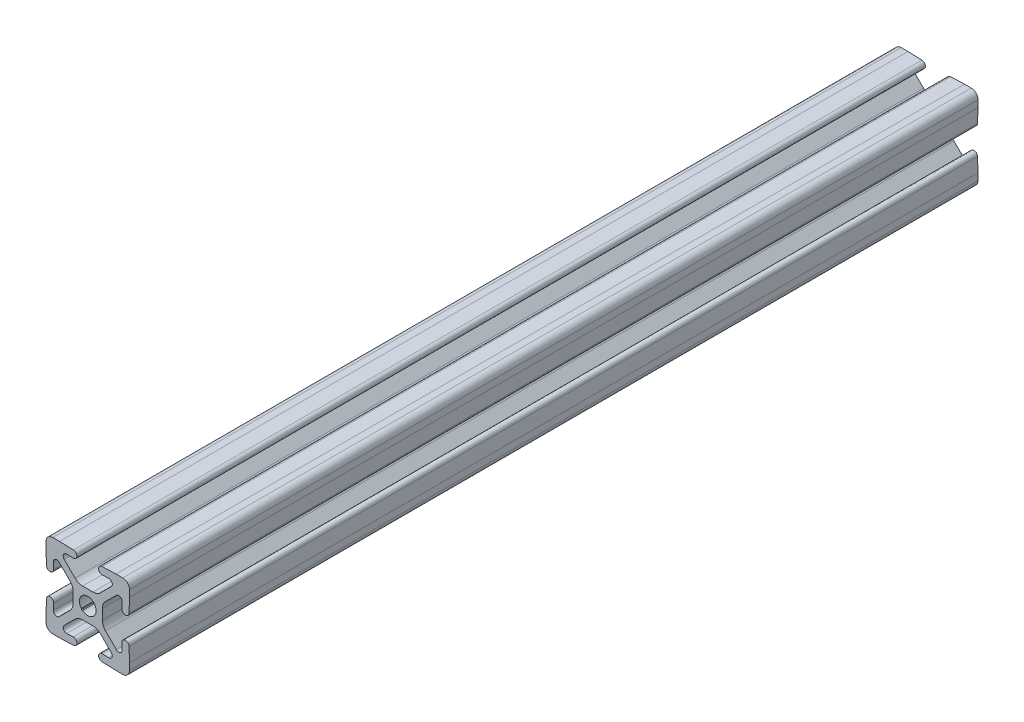
from build123d import *

# Parameters (mm, degrees)
BOSS_EXTRUDE1_DEPTH = 254


with BuildPart() as part:
    # Model → Boss-Extrude1 (new body)
    with BuildSketch(Plane.XY):
        with BuildLine():
            Line((50.659960212, 72.999871414), (53.774553856, 72.999871414))
            ThreePointArc((53.774553856, 72.999871414), (54.989573754, 72.758188929), (56.019617887, 72.069935444))
            Line((56.019617887, 72.069935444), (59.264200891, 68.825352439))
            ThreePointArc((59.264200891, 68.825352439), (59.477513437, 67.701802895), (58.510322513, 67.091550869))
            Line((58.510322513, 67.091550869), (56.572487817, 67.159221548))
            ThreePointArc((56.572487817, 67.159221548), (55.4691069, 66.130302197), (56.498026251, 65.026921279))
            Line((56.498026251, 65.026921279), (60.677257034, 64.880979325))
            Line((60.677257034, 64.880979325), (62.710657034, 64.880979325))
            ThreePointArc((62.710657034, 64.880979325), (64.129537501, 65.468698857), (64.717257034, 66.887579325))
            Line((64.717257034, 66.887579325), (64.717257034, 68.920979325))
            Line((64.717257034, 68.920979325), (64.57131508, 73.100210108))
            ThreePointArc((64.57131508, 73.100210108), (63.467934162, 74.129129459), (62.439014811, 73.025748542))
            Line((62.439014811, 73.025748542), (62.50668549, 71.087913846))
            ThreePointArc((62.50668549, 71.087913846), (61.896433464, 70.120722922), (60.77288392, 70.334035468))
            Line((60.77288392, 70.334035468), (57.528300915, 73.578618472))
            ThreePointArc((57.528300915, 73.578618472), (56.84004743, 74.608662605), (56.598364945, 75.823682503))
            Line((56.598364945, 75.823682503), (56.598364945, 78.938276147))
            ThreePointArc((56.598364945, 78.938276147), (56.84004743, 80.153296044), (57.528300915, 81.183340177))
            Line((57.528300915, 81.183340177), (60.77288392, 84.427923182))
            ThreePointArc((60.77288392, 84.427923182), (61.896433464, 84.641235728), (62.50668549, 83.674044803))
            Line((62.50668549, 83.674044803), (62.439014811, 81.736210108))
            ThreePointArc((62.439014811, 81.736210108), (63.467934162, 80.63282919), (64.57131508, 81.661748542))
            Line((64.57131508, 81.661748542), (64.717257034, 85.840979325))
            Line((64.717257034, 85.840979325), (64.717257034, 87.874379325))
            ThreePointArc((64.717257034, 87.874379325), (64.129537501, 89.293259792), (62.710657034, 89.880979325))
            Line((62.710657034, 89.880979325), (60.677257034, 89.880979325))
            Line((60.677257034, 89.880979325), (56.498026251, 89.73503737))
            ThreePointArc((56.498026251, 89.73503737), (55.4691069, 88.631656452), (56.572487817, 87.602737101))
            Line((56.572487817, 87.602737101), (58.510322513, 87.67040778))
            ThreePointArc((58.510322513, 87.67040778), (59.477513437, 87.060155754), (59.264200891, 85.93660621))
            Line((59.264200891, 85.93660621), (56.019617887, 82.692023205))
            ThreePointArc((56.019617887, 82.692023205), (54.989573754, 82.00376972), (53.774553856, 81.762087236))
            Line((53.774553856, 81.762087236), (50.659960212, 81.762087236))
            ThreePointArc((50.659960212, 81.762087236), (49.444940315, 82.00376972), (48.414896182, 82.692023205))
            Line((48.414896182, 82.692023205), (45.170313177, 85.93660621))
            ThreePointArc((45.170313177, 85.93660621), (44.957000631, 87.060155754), (45.924191556, 87.67040778))
            Line((45.924191556, 87.67040778), (47.862026251, 87.602737101))
            ThreePointArc((47.862026251, 87.602737101), (48.965407169, 88.631656452), (47.936487817, 89.73503737))
            Line((47.936487817, 89.73503737), (43.757257034, 89.880979325))
            Line((43.757257034, 89.880979325), (41.723857034, 89.880979325))
            ThreePointArc((41.723857034, 89.880979325), (40.304976567, 89.293259792), (39.717257034, 87.874379325))
            Line((39.717257034, 87.874379325), (39.717257034, 85.840979325))
            Line((39.717257034, 85.840979325), (39.863198989, 81.661748542))
            ThreePointArc((39.863198989, 81.661748542), (40.966579907, 80.63282919), (41.995499258, 81.736210108))
            Line((41.995499258, 81.736210108), (41.927828579, 83.674044803))
            ThreePointArc((41.927828579, 83.674044803), (42.538080605, 84.641235728), (43.661630149, 84.427923182))
            Line((43.661630149, 84.427923182), (46.906213154, 81.183340177))
            ThreePointArc((46.906213154, 81.183340177), (47.594466639, 80.153296044), (47.836149123, 78.938276147))
            Line((47.836149123, 78.938276147), (47.836149123, 75.823682503))
            ThreePointArc((47.836149123, 75.823682503), (47.594466639, 74.608662605), (46.906213154, 73.578618472))
            Line((46.906213154, 73.578618472), (43.661630149, 70.334035468))
            ThreePointArc((43.661630149, 70.334035468), (42.538080605, 70.120722922), (41.927828579, 71.087913846))
            Line((41.927828579, 71.087913846), (41.995499258, 73.025748542))
            ThreePointArc((41.995499258, 73.025748542), (40.966579907, 74.129129459), (39.863198989, 73.100210108))
            Line((39.863198989, 73.100210108), (39.717257034, 68.920979325))
            Line((39.717257034, 68.920979325), (39.717257034, 66.887579325))
            ThreePointArc((39.717257034, 66.887579325), (40.304976567, 65.468698857), (41.723857034, 64.880979325))
            Line((41.723857034, 64.880979325), (43.757257034, 64.880979325))
            Line((43.757257034, 64.880979325), (47.936487817, 65.026921279))
            ThreePointArc((47.936487817, 65.026921279), (48.965407169, 66.130302197), (47.862026251, 67.159221548))
            Line((47.862026251, 67.159221548), (45.924191556, 67.091550869))
            ThreePointArc((45.924191556, 67.091550869), (44.957000631, 67.701802895), (45.170313177, 68.825352439))
            Line((45.170313177, 68.825352439), (48.414896182, 72.069935444))
            ThreePointArc((48.414896182, 72.069935444), (49.444940315, 72.758188929), (50.659960212, 72.999871414))
        make_face()
        with BuildLine():
            Line((50.64953831, 75.433607249), (50.269884959, 75.433607249))
            Line((50.269884959, 75.433607249), (50.269884959, 75.8132606))
            ThreePointArc((50.269884959, 75.8132606), (53.985023987, 79.148746278), (50.64953831, 75.433607249))
        make_face(mode=Mode.SUBTRACT)
    extrude(amount=BOSS_EXTRUDE1_DEPTH)


solid = part.part
